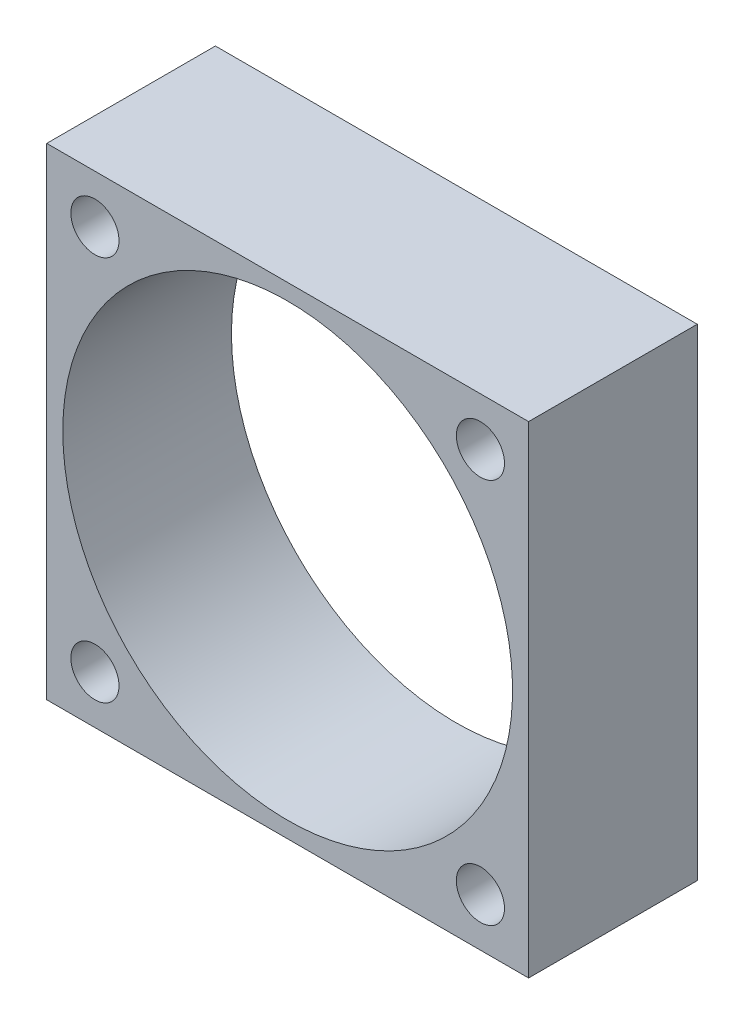
from build123d import *

# Parameters (mm, degrees)
SKETCH_1_W      = 30
SKETCH_1_H      = 30
SKETCH_1_R      = 14
SKETCH_1_R_2    = 1.5
EXTRUDE_1_DEPTH = 10.5


with BuildPart() as part:
    # 草图1 → 凸台-拉伸1 (new body)
    with BuildSketch(Plane.XY):
        Rectangle(SKETCH_1_W, SKETCH_1_H)
        with Locations(Location((0, 0, 0), (0, 0, 180))):
            Circle(SKETCH_1_R, mode=Mode.SUBTRACT)
        with Locations(Location((-12, 12, 0), (0, 0, 180))):
            Circle(SKETCH_1_R_2, mode=Mode.SUBTRACT)
        with Locations(Location((12, 12, 0), (0, 0, 180))):
            Circle(SKETCH_1_R_2, mode=Mode.SUBTRACT)
        with Locations(Location((12, -12, 0), (0, 0, 180))):
            Circle(SKETCH_1_R_2, mode=Mode.SUBTRACT)
        with Locations(Location((-12, -12, 0), (0, 0, 180))):
            Circle(SKETCH_1_R_2, mode=Mode.SUBTRACT)
    extrude(amount=EXTRUDE_1_DEPTH)


solid = part.part
